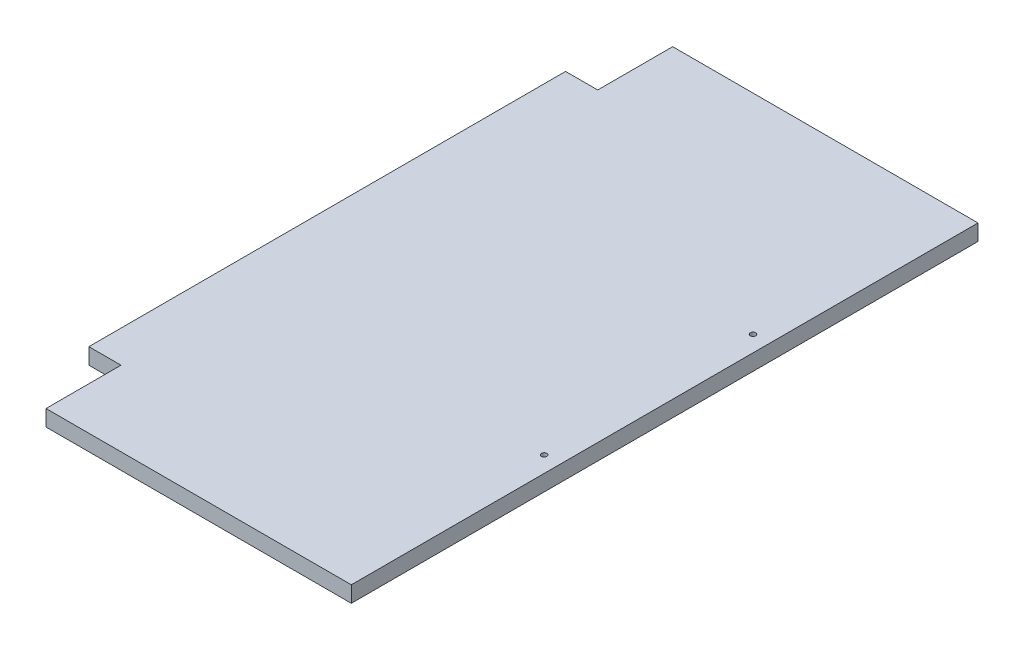
from build123d import *

# Parameters (mm, degrees)
SKETCH1_R           = 3.175
BOSS_EXTRUDE1_DEPTH = 19.05


with BuildPart() as part:
    # Sketch1 → Boss-Extrude1 (new body)
    with BuildSketch(Plane(origin=(0, 0, 0), x_dir=(1, 0, 0), z_dir=(0, 1, 0))):
        Polygon((0, 0), (38.1, 0), (38.1, 88.9), (400.05, 88.9), (400.05, -654.05), (38.1, -654.05), (38.1, -565.15), (0, -565.15), align=None)
        with Locations(Location((381, -406.4, 0), (0, 0, 90))):
            Circle(SKETCH1_R, mode=Mode.SUBTRACT)
        with Locations(Location((381, -158.75, 0), (0, 0, 90))):
            Circle(SKETCH1_R, mode=Mode.SUBTRACT)
    extrude(amount=BOSS_EXTRUDE1_DEPTH)


solid = part.part
